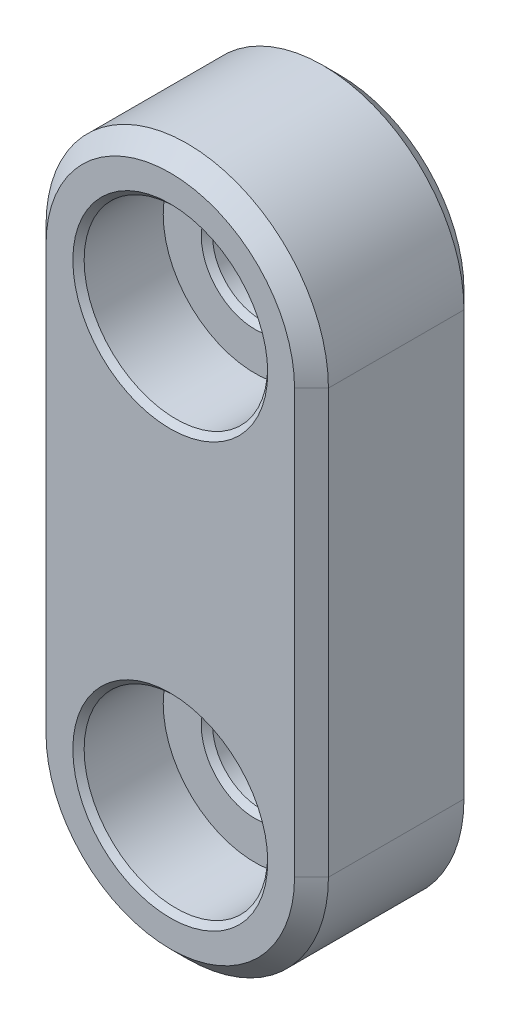
from build123d import *

# Parameters (mm, degrees)
BOSS_EXTRUDE1_DEPTH            = 6
CHAMFER1_SIZE                  = 0.6
CBORE_FOR_M3_SHCS1_D           = 3.4
CBORE_FOR_M3_SHCS1_CBORE_D     = 6.5
CBORE_FOR_M3_SHCS1_CBORE_DEPTH = 3
DEBURS_SIZE                    = 0.2


with BuildPart() as part:
    # Sketch1 → Boss-Extrude1 (new body)
    with BuildSketch(Plane.XY):
        with BuildLine():
            Line((-5, -7.5), (-5, 7.5))
            ThreePointArc((-5, 7.5), (0, 12.5), (5, 7.5))
            Line((5, 7.5), (5, -7.5))
            ThreePointArc((5, -7.5), (0, -12.5), (-5, -7.5))
        make_face()
    extrude(amount=BOSS_EXTRUDE1_DEPTH)

    # Chamfer1
    chamfer1_edges = [part.edges().sort_by_distance(p)[0] for p in [
        (0, 12.5, 6),
        (-5, 0, 6),
        (0, -12.5, 6),
        (-5, 0, 0),
        (0, 12.5, 0),
        (5, 0, 0),
        (0, -12.5, 0),
        (5, 0, 6),
    ]]
    chamfer(chamfer1_edges, length=CHAMFER1_SIZE)

    # CBORE for M3 SHCS1 (through all)
    with Locations(Plane.XY.offset(6)):
        with Locations((0, 7.5), (0, -7.5)):
            CounterBoreHole(CBORE_FOR_M3_SHCS1_D / 2, CBORE_FOR_M3_SHCS1_CBORE_D / 2, CBORE_FOR_M3_SHCS1_CBORE_DEPTH)

    # Deburs
    deburs_edges = [part.edges().sort_by_distance(p)[0] for p in [
        (-3.25, -7.5, 6),
        (1.7, -7.5, 0),
        (1.7, -7.5, 3),
        (-3.25, 7.5, 6),
        (1.7, 7.5, 0),
        (1.7, 7.5, 3),
    ]]
    chamfer(deburs_edges, length=DEBURS_SIZE)


solid = part.part
